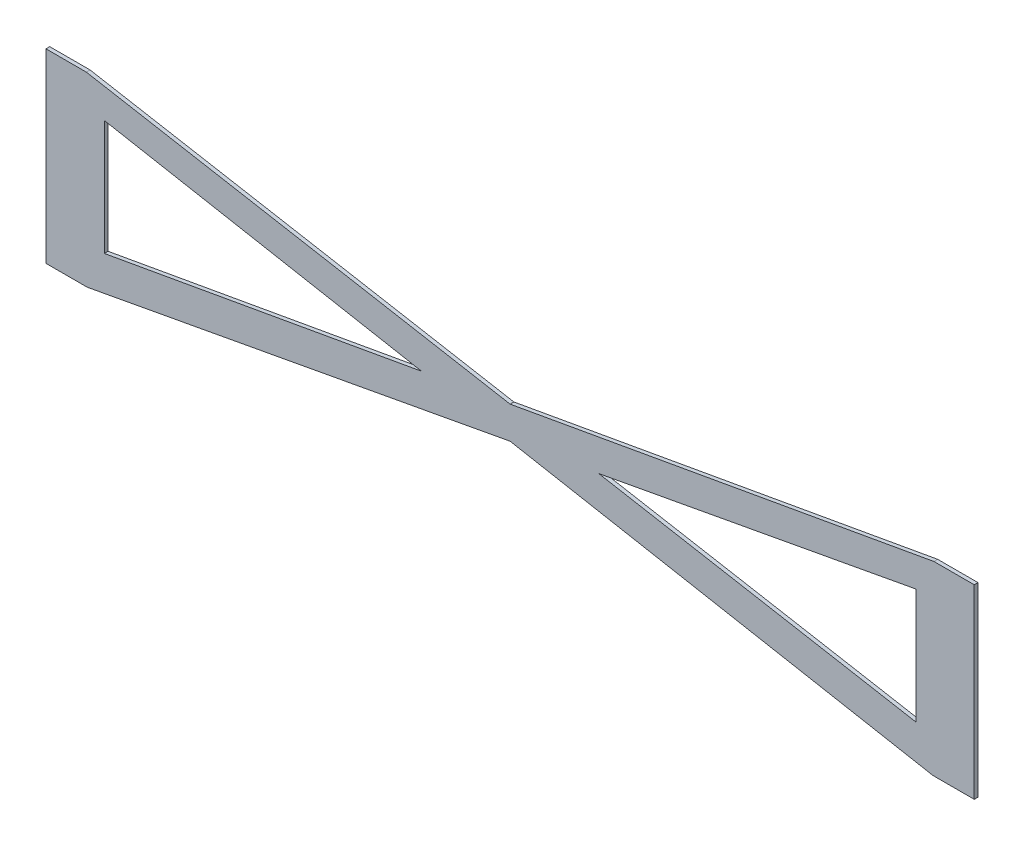
from build123d import *

# Parameters (mm, degrees)
BOSS_EXTRUDE1_DEPTH = 1


with BuildPart() as part:
    # Sketch1 → Boss-Extrude1 (new body)
    with BuildSketch(Plane.XY):
        Polygon((0, 0), (10.985406775, 0), (123.4989795, 20.769522906), (236.012552225, 0), (246.997959, 0), (246.997959, 49.45), (236.267497729, 49.45), (123.4989795, 29.326227234), (10.730461271, 49.45), (0, 49.45), align=None)
        Polygon((15.5, 40.705671267), (99.929892015, 25.120275357), (15.5, 10.053588411), align=None, mode=Mode.SUBTRACT)
        Polygon((231.497959, 40.705671267), (147.068066985, 25.120275357), (231.497959, 10.053588411), align=None, mode=Mode.SUBTRACT)
    extrude(amount=BOSS_EXTRUDE1_DEPTH)


solid = part.part
